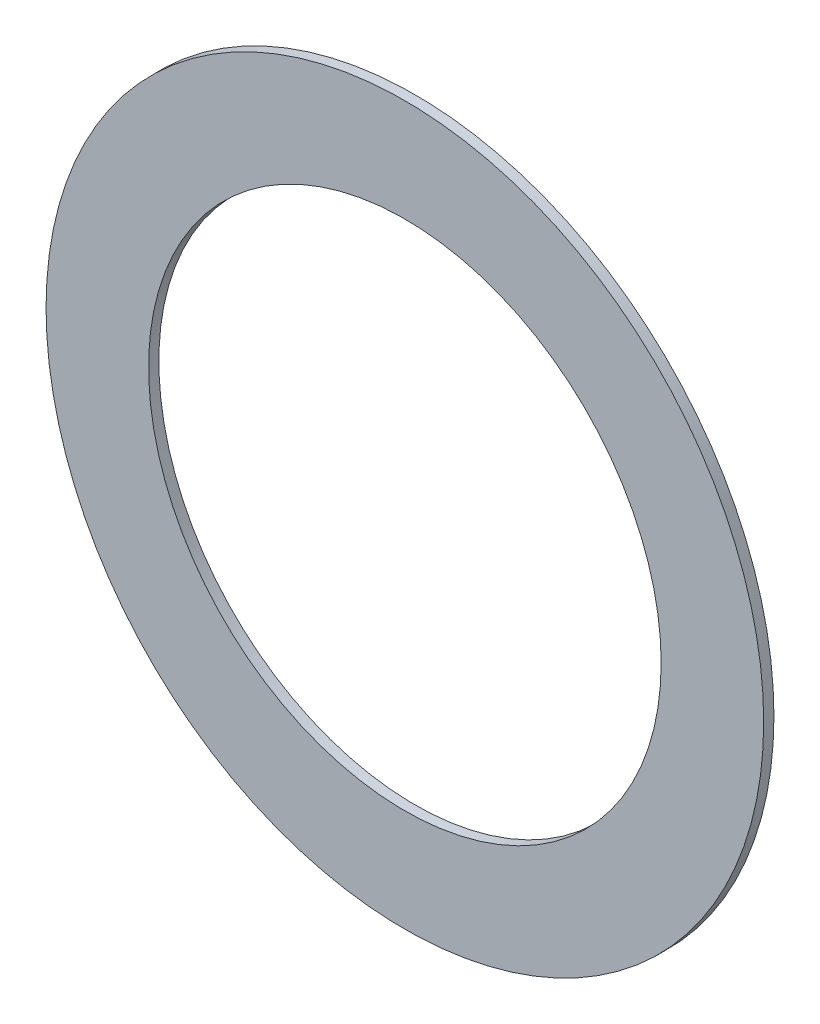
from build123d import *

# Parameters (mm, degrees)
SKETCH1_R           = 35
SKETCH1_R_2         = 25
BOSS_EXTRUDE1_DEPTH = 1


with BuildPart() as part:
    # Sketch1 → Boss-Extrude1 (new body)
    with BuildSketch(Plane.XY):
        Circle(SKETCH1_R)
        Circle(SKETCH1_R_2, mode=Mode.SUBTRACT)
    extrude(amount=BOSS_EXTRUDE1_DEPTH)


solid = part.part
